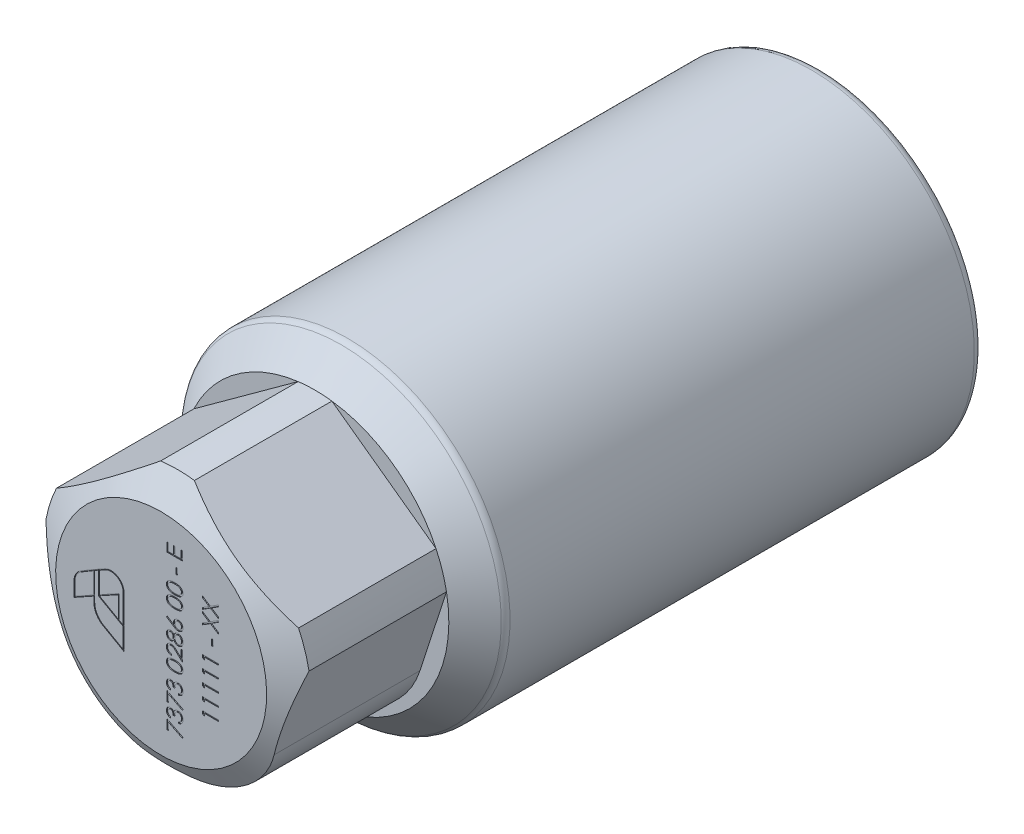
from build123d import *

# Parameters (mm, degrees)
SKETCH2_OUTSIDE_W      = 57.29
SKETCH2_OUTSIDE_H      = 57.29
CUT_EXTRUDE3_DEPTH     = 17.5
SKETCH3_W              = 0.184615385
SKETCH3_H              = 0.692307692
P_N_CUT_EXTRUDE7_DEPTH = 0.1


with BuildPart() as part:
    # Sketch1 → Revolve1 (revolve)
    with BuildSketch(Plane(origin=(0, 0, 0), x_dir=(0, 0, -1), z_dir=(1, 0, 0))):
        with BuildLine():
            Line((0, 10.75), (0, 17.5))
            ThreePointArc((0, 17.5), (-0.292893219, 18.207106781), (-1, 18.5))
            Line((-1, 18.5), (-53.810786438, 18.5))
            ThreePointArc((-53.810786438, 18.5), (-54.19346987, 18.423879533), (-54.517893219, 18.207106781))
            Line((-54.517893219, 18.207106781), (-57.5, 15.225))
            Line((-57.5, 15.225), (-73.138045382, 15.225))
            Line((-73.138045382, 15.225), (-75, 12))
            Line((-75, 12), (-75, 0))
            Line((-75, 0), (-53, 0))
            Line((-53, 0), (-49.272077939, 9))
            Line((-49.272077939, 9), (-6.25, 9))
            Line((-6.25, 9), (-5, 10.25))
            Line((-5, 10.25), (-0.5, 10.25))
            Line((-0.5, 10.25), (0, 10.75))
        make_face()
    revolve(axis=Axis((0, 0, 0), (0, 0, 1)))

    # Sketch2 outside → Cut-Extrude3 (cut)
    with BuildSketch(Plane.XY.offset(75)):
        Rectangle(SKETCH2_OUTSIDE_W, SKETCH2_OUTSIDE_H)
        with BuildLine():
            Line((0, 16.5), (-15.692432519, 5.098780407))
            Line((-15.692432519, 5.098780407), (-11.943596546, -6.438950351))
            ThreePointArc((-11.943596546, -6.438950351), (-8.310883906, -11.438950351), (-2.433031383, -13.348780407))
            Line((-2.433031383, -13.348780407), (2.433031383, -13.348780407))
            ThreePointArc((2.433031383, -13.348780407), (8.310883906, -11.438950351), (11.943596546, -6.438950351))
            Line((11.943596546, -6.438950351), (15.692432519, 5.098780407))
            Line((15.692432519, 5.098780407), (0, 16.5))
        make_face(mode=Mode.SUBTRACT)
    extrude(amount=-CUT_EXTRUDE3_DEPTH, mode=Mode.SUBTRACT)

    # Sketch3 → P/N Cut-Extrude7 (cut)
    # profile 1 of 21: a face of its own
    with BuildSketch(Plane(origin=(0, 19, 75), x_dir=(1, 0, 0), z_dir=(0, 0, -1))):
        Polygon((0.650687376, 10.65491147), (0.650687376, 9.639526854), (0.83530276, 9.639526854), (0.83530276, 10.493373008), (1.389148914, 10.493373008), (1.389148914, 9.639526854), (1.573764299, 9.639526854), (1.573764299, 10.493373008), (2.266071991, 10.493373008), (2.266071991, 9.639526854), (2.450687376, 9.639526854), (2.450687376, 10.65491147), align=None)
    # profile 2 of 21: a face of its own
    with BuildSketch(Plane(origin=(0, 19, 75), x_dir=(1, 0, 0), z_dir=(0, 0, -1))):
        with Locations((1.758379684, 11.993373008)):
            Rectangle(SKETCH3_W, SKETCH3_H)
    # profile 3 of 21: a face of its own
    with BuildSketch(Plane(origin=(0, 19, 75), x_dir=(1, 0, 0), z_dir=(0, 0, -1))):
        with BuildLine():
            add(Edge.make_bspline(
                [(1.55140853, 14.416449931), (1.522558444, 14.416281236), (1.466516738, 14.415953544), (1.384856065, 14.41230807), (1.308247916, 14.40625218), (1.236688626, 14.397952959), (1.170159717, 14.387853427), (1.108838989, 14.374371173), (1.052442606, 14.359038888), (1.000786742, 14.341269015), (0.95317519, 14.321218303), (0.908728517, 14.299394435), (0.867510633, 14.274934434), (0.828875608, 14.249225253), (0.793413508, 14.221266037), (0.760715743, 14.191656284), (0.731058058, 14.159803796), (0.704420145, 14.126017512), (0.681062581, 14.090526417), (0.660361734, 14.054300351), (0.643310557, 14.016692034), (0.629362224, 13.978196559), (0.617975878, 13.938732792), (0.610154625, 13.898310807), (0.605242256, 13.856836904), (0.604772013, 13.828843759), (0.60453353, 13.814647047)],
                knots=[0, 0, 0, 0, 1.646148282, 3.197666765, 4.66315463, 6.030252048, 7.307778049, 8.501004361, 9.610818041, 10.641065266, 11.615491391, 12.557119604, 13.464013759, 14.348536654, 15.203310953, 16.038349431, 16.863300206, 17.683791446, 18.490318933, 19.285717724, 20.06220424, 20.843281102, 21.620494212, 22.403315558, 23.190242141, 24, 24, 24, 24], degree=3))
            add(Edge.make_bspline(
                [(0.60453353, 13.814647047), (0.604732172, 13.800324715), (0.605127402, 13.771828316), (0.610690491, 13.729849669), (0.617870932, 13.688602218), (0.629387177, 13.648711768), (0.643167857, 13.609424069), (0.661351246, 13.571716125), (0.681127093, 13.534256649), (0.705251963, 13.498747372), (0.731913914, 13.464127344), (0.762182045, 13.431674682), (0.795218682, 13.400559809), (0.831760638, 13.371957923), (0.871247617, 13.344643186), (0.914010634, 13.319652493), (0.959954919, 13.296466083), (1.008867482, 13.274648113), (1.062054854, 13.255568875), (1.11918529, 13.238605907), (1.180776134, 13.224701884), (1.246484286, 13.213203502), (1.316635263, 13.204278569), (1.391086932, 13.197783153), (1.46988587, 13.194350891), (1.523761352, 13.193704642), (1.55140853, 13.193373008)],
                knots=[0, 0, 0, 0, 0.810910589, 1.61342667, 2.396193133, 3.181089899, 3.963115317, 4.752255436, 5.550715454, 6.36105385, 7.181178335, 8.024612154, 8.872680183, 9.750181803, 10.651284446, 11.591556747, 12.554036451, 13.566402641, 14.62422919, 15.753422176, 16.94128843, 18.199818041, 19.531985927, 20.947085226, 22.433341622, 24, 24, 24, 24], degree=3))
            add(Edge.make_bspline(
                [(1.55140853, 13.193373008), (1.57893487, 13.193711938), (1.632688878, 13.194373808), (1.711136955, 13.197709541), (1.785187314, 13.204437222), (1.854918902, 13.212729935), (1.92036405, 13.224356834), (1.981480114, 13.238366285), (2.038483473, 13.254327971), (2.090965705, 13.273700025), (2.13979339, 13.295010163), (2.18539985, 13.318171692), (2.228151573, 13.343021359), (2.267742705, 13.369926439), (2.304137988, 13.398998797), (2.337287935, 13.43009186), (2.367748584, 13.462827872), (2.394704271, 13.497649729), (2.419012816, 13.533489753), (2.439506317, 13.570953035), (2.457262734, 13.60908079), (2.471780242, 13.648253688), (2.48303874, 13.688411246), (2.490778343, 13.729686968), (2.49621869, 13.77183424), (2.496632993, 13.800326697), (2.496841222, 13.814647047)],
                knots=[0, 0, 0, 0, 1.561645053, 3.049612875, 4.452756685, 5.778837748, 7.032101753, 8.221335837, 9.334924186, 10.387562255, 11.392109817, 12.355697819, 13.287721948, 14.19548756, 15.068665045, 15.927346723, 16.771751757, 17.602390507, 18.423119567, 19.225778204, 20.022010933, 20.807278863, 21.593079439, 22.384715467, 23.188155646, 24, 24, 24, 24], degree=3))
            add(Edge.make_bspline(
                [(2.496841222, 13.814647047), (2.496601382, 13.828843448), (2.496128464, 13.856835981), (2.491235688, 13.898314371), (2.483369429, 13.938573913), (2.472355177, 13.977813274), (2.458873257, 14.016233761), (2.441308521, 14.053311875), (2.421079512, 14.089459739), (2.398042092, 14.124581444), (2.371647222, 14.158014995), (2.34245744, 14.189956277), (2.309724219, 14.219573332), (2.273962911, 14.247290117), (2.235270404, 14.27327109), (2.193620733, 14.297519724), (2.14894278, 14.319801255), (2.100954949, 14.34019453), (2.048932456, 14.358275443), (1.992392313, 14.374184881), (1.930760242, 14.38689126), (1.86434916, 14.397661881), (1.793024125, 14.406292521), (1.716759334, 14.412305555), (1.635699605, 14.415950776), (1.580018277, 14.41628051), (1.55140853, 14.416449931)],
                knots=[0, 0, 0, 0, 0.810927267, 1.598990287, 2.382942141, 3.152806972, 3.926217614, 4.706701772, 5.493896336, 6.292070767, 7.104102563, 7.925577746, 8.761822141, 9.623241997, 10.509042271, 11.423174113, 12.375371989, 13.360203808, 14.400680605, 15.520553799, 16.714061498, 17.994519714, 19.364400916, 20.818312473, 22.365209998, 24, 24, 24, 24], degree=3))
        make_face()
        with BuildLine():
            add(Edge.make_bspline(
                [(1.550687376, 14.25491147), (1.574729468, 14.254848693), (1.621390447, 14.254726855), (1.689077042, 14.251636045), (1.752314402, 14.247333954), (1.811077845, 14.241921675), (1.865161996, 14.233816017), (1.914791702, 14.224619653), (1.959875098, 14.213589176), (2.000806161, 14.200473788), (2.038164491, 14.185534085), (2.072945819, 14.169251194), (2.10556237, 14.151603735), (2.13593501, 14.132229973), (2.163692468, 14.110746876), (2.189538332, 14.088150402), (2.212573705, 14.063422593), (2.24020564, 14.029222189), (2.268757874, 13.984068999), (2.293621717, 13.927178695), (2.309246945, 13.868720581), (2.311234024, 13.829042802), (2.312225837, 13.809238393)],
                knots=[0, 0, 0, 0, 1.459098681, 2.831824031, 4.11146945, 5.306290378, 6.412266529, 7.42953815, 8.369053297, 9.227277979, 10.03601793, 10.809473603, 11.557037441, 12.285528272, 12.993193355, 13.685654407, 14.36688038, 15.041354379, 16.352855396, 17.594313975, 18.799247529, 20, 20, 20, 20], degree=3))
            add(Edge.make_bspline(
                [(2.312225837, 13.809238393), (2.311357387, 13.789319343), (2.309623566, 13.749551902), (2.294491463, 13.691147486), (2.269891469, 13.634917293), (2.241786559, 13.590541021), (2.214849974, 13.556874027), (2.191910424, 13.532743281), (2.166217411, 13.510597643), (2.138498169, 13.489592993), (2.108220781, 13.470328368), (2.075531488, 13.452810171), (2.04033933, 13.436824453), (2.015772037, 13.427716943), (2.003211414, 13.423060508)],
                knots=[0, 0, 0, 0, 1.353621445, 2.702441307, 4.075953605, 5.516772412, 6.261413105, 7.007624062, 7.778524365, 8.566925914, 9.372323995, 10.217594641, 11.088702136, 12, 12, 12, 12], degree=3))
            add(Edge.make_bspline(
                [(2.003211414, 13.423060508), (1.987150405, 13.417633885), (1.954539669, 13.406615512), (1.903952648, 13.392415171), (1.850876941, 13.381231823), (1.795629738, 13.371170663), (1.737803606, 13.364303377), (1.677577466, 13.35877593), (1.614905908, 13.355520149), (1.572325627, 13.355116562), (1.550687376, 13.35491147)],
                knots=[0, 0, 0, 0, 0.884706709, 1.796334032, 2.740027952, 3.714592787, 4.726048262, 5.777819803, 6.87074269, 8, 8, 8, 8], degree=3))
            add(Edge.make_bspline(
                [(1.550687376, 13.35491147), (1.529052624, 13.355194424), (1.486730425, 13.355747944), (1.424749646, 13.357863709), (1.365880512, 13.363327261), (1.309869412, 13.36939538), (1.257026398, 13.378342521), (1.206909103, 13.387989397), (1.16013839, 13.400950006), (1.115982084, 13.414794511), (1.074941572, 13.430639687), (1.036826516, 13.448082653), (1.001449396, 13.466708927), (0.968919517, 13.486949276), (0.939048191, 13.508521772), (0.912522756, 13.532199883), (0.888052896, 13.556479874), (0.860620375, 13.591011139), (0.832428931, 13.635851038), (0.807191189, 13.692031896), (0.792254811, 13.750176662), (0.790183467, 13.789565344), (0.789148914, 13.809238393)],
                knots=[0, 0, 0, 0, 1.313483664, 2.569454835, 3.763100662, 4.901599063, 5.988328865, 7.015709358, 7.99797933, 8.932480776, 9.824041341, 10.666387587, 11.475829342, 12.24921787, 12.990555181, 13.709176526, 14.405678811, 15.080244297, 16.38186033, 17.610124501, 18.806354173, 20, 20, 20, 20], degree=3))
            add(Edge.make_bspline(
                [(0.789148914, 13.809238393), (0.790186041, 13.829149721), (0.792262183, 13.869008653), (0.807122112, 13.927774351), (0.832355091, 13.984334745), (0.860566061, 14.029322509), (0.887947716, 14.063434277), (0.911252658, 14.087640788), (0.936481205, 14.110550644), (0.964484903, 14.131477439), (0.994750525, 14.15073632), (1.026945287, 14.16906579), (1.061791604, 14.185130936), (1.09912064, 14.200118602), (1.140053954, 14.213255866), (1.185300478, 14.224160308), (1.235048703, 14.234087513), (1.289528023, 14.241236718), (1.348304009, 14.247532069), (1.411703087, 14.251588816), (1.479622112, 14.254741014), (1.526524508, 14.254853513), (1.550687376, 14.25491147)],
                knots=[0, 0, 0, 0, 1.207546505, 2.417292871, 3.651582144, 4.952510111, 5.626719005, 6.30238548, 6.989136872, 7.692112372, 8.420316868, 9.164734959, 9.937886623, 10.746308695, 11.604196049, 12.543341915, 13.568754172, 14.680483261, 15.875568977, 17.154711427, 18.534182925, 20, 20, 20, 20], degree=3))
        make_face(mode=Mode.SUBTRACT)
    # profile 4 of 21: a face of its own
    with BuildSketch(Plane(origin=(0, 19, 75), x_dir=(1, 0, 0), z_dir=(0, 0, -1))):
        with BuildLine():
            add(Edge.make_bspline(
                [(1.55140853, 15.801065316), (1.522558444, 15.800896621), (1.466516738, 15.800568928), (1.384856065, 15.796923455), (1.308247916, 15.790867564), (1.236688626, 15.782568344), (1.170159717, 15.772468812), (1.108838989, 15.758986558), (1.052442606, 15.743654273), (1.000786742, 15.725884399), (0.95317519, 15.705833688), (0.908728517, 15.68400982), (0.867510633, 15.659549819), (0.828875608, 15.633840638), (0.793413508, 15.605881422), (0.760715743, 15.576271669), (0.731058058, 15.54441918), (0.704420145, 15.510632896), (0.681062581, 15.475141802), (0.660361734, 15.438915736), (0.643310557, 15.401307419), (0.629362224, 15.362811944), (0.617975878, 15.323348177), (0.610154625, 15.282926192), (0.605242256, 15.241452289), (0.604772013, 15.213459143), (0.60453353, 15.199262431)],
                knots=[0, 0, 0, 0, 1.646148282, 3.197666765, 4.66315463, 6.030252048, 7.307778049, 8.501004361, 9.610818041, 10.641065266, 11.615491391, 12.557119604, 13.464013759, 14.348536654, 15.203310953, 16.038349431, 16.863300206, 17.683791446, 18.490318933, 19.285717724, 20.06220424, 20.843281102, 21.620494212, 22.403315558, 23.190242141, 24, 24, 24, 24], degree=3))
            add(Edge.make_bspline(
                [(0.60453353, 15.199262431), (0.604732172, 15.1849401), (0.605127402, 15.156443701), (0.610690491, 15.114465053), (0.617870932, 15.073217602), (0.629387177, 15.033327153), (0.643167857, 14.994039453), (0.661351246, 14.95633151), (0.681127093, 14.918872033), (0.705251963, 14.883362757), (0.731913914, 14.848742728), (0.762182045, 14.816290066), (0.795218682, 14.785175194), (0.831760638, 14.756573308), (0.871247617, 14.729258571), (0.914010634, 14.704267877), (0.959954919, 14.681081467), (1.008867482, 14.659263498), (1.062054854, 14.640184259), (1.11918529, 14.623221291), (1.180776134, 14.609317269), (1.246484286, 14.597818887), (1.316635263, 14.588893953), (1.391086932, 14.582398538), (1.46988587, 14.578966275), (1.523761352, 14.578320027), (1.55140853, 14.577988393)],
                knots=[0, 0, 0, 0, 0.810910589, 1.61342667, 2.396193133, 3.181089899, 3.963115317, 4.752255436, 5.550715454, 6.36105385, 7.181178335, 8.024612154, 8.872680183, 9.750181803, 10.651284446, 11.591556747, 12.554036451, 13.566402641, 14.62422919, 15.753422176, 16.94128843, 18.199818041, 19.531985927, 20.947085226, 22.433341622, 24, 24, 24, 24], degree=3))
            add(Edge.make_bspline(
                [(1.55140853, 14.577988393), (1.57893487, 14.578327323), (1.632688878, 14.578989193), (1.711136955, 14.582324925), (1.785187314, 14.589052606), (1.854918902, 14.59734532), (1.92036405, 14.608972218), (1.981480114, 14.62298167), (2.038483473, 14.638943356), (2.090965705, 14.658315409), (2.13979339, 14.679625548), (2.18539985, 14.702787077), (2.228151573, 14.727636744), (2.267742705, 14.754541823), (2.304137988, 14.783614181), (2.337287935, 14.814707245), (2.367748584, 14.847443257), (2.394704271, 14.882265114), (2.419012816, 14.918105137), (2.439506317, 14.95556842), (2.457262734, 14.993696175), (2.471780242, 15.032869072), (2.48303874, 15.073026631), (2.490778343, 15.114302353), (2.49621869, 15.156449625), (2.496632993, 15.184942081), (2.496841222, 15.199262431)],
                knots=[0, 0, 0, 0, 1.561645053, 3.049612875, 4.452756685, 5.778837748, 7.032101753, 8.221335837, 9.334924186, 10.387562255, 11.392109817, 12.355697819, 13.287721948, 14.19548756, 15.068665045, 15.927346723, 16.771751757, 17.602390507, 18.423119567, 19.225778204, 20.022010933, 20.807278863, 21.593079439, 22.384715467, 23.188155646, 24, 24, 24, 24], degree=3))
            add(Edge.make_bspline(
                [(2.496841222, 15.199262431), (2.496601382, 15.213458833), (2.496128464, 15.241451365), (2.491235688, 15.282929756), (2.483369429, 15.323189298), (2.472355177, 15.362428658), (2.458873257, 15.400849146), (2.441308521, 15.437927259), (2.421079512, 15.474075123), (2.398042092, 15.509196829), (2.371647222, 15.542630379), (2.34245744, 15.574571662), (2.309724219, 15.604188716), (2.273962911, 15.631905501), (2.235270404, 15.657886474), (2.193620733, 15.682135109), (2.14894278, 15.70441664), (2.100954949, 15.724809914), (2.048932456, 15.742890827), (1.992392313, 15.758800265), (1.930760242, 15.771506645), (1.86434916, 15.782277266), (1.793024125, 15.790907906), (1.716759334, 15.79692094), (1.635699605, 15.800566161), (1.580018277, 15.800895895), (1.55140853, 15.801065316)],
                knots=[0, 0, 0, 0, 0.810927267, 1.598990287, 2.382942141, 3.152806972, 3.926217614, 4.706701772, 5.493896336, 6.292070767, 7.104102563, 7.925577746, 8.761822141, 9.623241997, 10.509042271, 11.423174113, 12.375371989, 13.360203808, 14.400680605, 15.520553799, 16.714061498, 17.994519714, 19.364400916, 20.818312473, 22.365209998, 24, 24, 24, 24], degree=3))
        make_face()
        with BuildLine():
            add(Edge.make_bspline(
                [(1.550687376, 15.639526854), (1.574729468, 15.639464077), (1.621390447, 15.63934224), (1.689077042, 15.63625143), (1.752314402, 15.631949338), (1.811077845, 15.626537059), (1.865161996, 15.618431402), (1.914791702, 15.609235038), (1.959875098, 15.598204561), (2.000806161, 15.585089173), (2.038164491, 15.57014947), (2.072945819, 15.553866579), (2.10556237, 15.53621912), (2.13593501, 15.516845358), (2.163692468, 15.495362261), (2.189538332, 15.472765787), (2.212573705, 15.448037978), (2.24020564, 15.413837574), (2.268757874, 15.368684383), (2.293621717, 15.31179408), (2.309246945, 15.253335965), (2.311234024, 15.213658187), (2.312225837, 15.193853777)],
                knots=[0, 0, 0, 0, 1.459098681, 2.831824031, 4.11146945, 5.306290378, 6.412266529, 7.42953815, 8.369053297, 9.227277979, 10.03601793, 10.809473603, 11.557037441, 12.285528272, 12.993193355, 13.685654407, 14.36688038, 15.041354379, 16.352855396, 17.594313975, 18.799247529, 20, 20, 20, 20], degree=3))
            add(Edge.make_bspline(
                [(2.312225837, 15.193853777), (2.311357387, 15.173934728), (2.309623566, 15.134167286), (2.294491463, 15.075762871), (2.269891469, 15.019532678), (2.241786559, 14.975156406), (2.214849974, 14.941489412), (2.191910424, 14.917358666), (2.166217411, 14.895213028), (2.138498169, 14.874208377), (2.108220781, 14.854943753), (2.075531488, 14.837425555), (2.04033933, 14.821439837), (2.015772037, 14.812332327), (2.003211414, 14.807675893)],
                knots=[0, 0, 0, 0, 1.353621445, 2.702441307, 4.075953605, 5.516772412, 6.261413105, 7.007624062, 7.778524365, 8.566925914, 9.372323995, 10.217594641, 11.088702136, 12, 12, 12, 12], degree=3))
            add(Edge.make_bspline(
                [(2.003211414, 14.807675893), (1.987150405, 14.802249269), (1.954539669, 14.791230896), (1.903952648, 14.777030555), (1.850876941, 14.765847207), (1.795629738, 14.755786048), (1.737803606, 14.748918762), (1.677577466, 14.743391315), (1.614905908, 14.740135533), (1.572325627, 14.739731947), (1.550687376, 14.739526854)],
                knots=[0, 0, 0, 0, 0.884706709, 1.796334032, 2.740027952, 3.714592787, 4.726048262, 5.777819803, 6.87074269, 8, 8, 8, 8], degree=3))
            add(Edge.make_bspline(
                [(1.550687376, 14.739526854), (1.529052624, 14.739809809), (1.486730425, 14.740363328), (1.424749646, 14.742479093), (1.365880512, 14.747942646), (1.309869412, 14.754010764), (1.257026398, 14.762957905), (1.206909103, 14.772604782), (1.16013839, 14.785565391), (1.115982084, 14.799409896), (1.074941572, 14.815255072), (1.036826516, 14.832698038), (1.001449396, 14.851324312), (0.968919517, 14.871564661), (0.939048191, 14.893137156), (0.912522756, 14.916815267), (0.888052896, 14.941095258), (0.860620375, 14.975626524), (0.832428931, 15.020466422), (0.807191189, 15.07664728), (0.792254811, 15.134792047), (0.790183467, 15.174180729), (0.789148914, 15.193853777)],
                knots=[0, 0, 0, 0, 1.313483664, 2.569454835, 3.763100662, 4.901599063, 5.988328865, 7.015709358, 7.99797933, 8.932480776, 9.824041341, 10.666387587, 11.475829342, 12.24921787, 12.990555181, 13.709176526, 14.405678811, 15.080244297, 16.38186033, 17.610124501, 18.806354173, 20, 20, 20, 20], degree=3))
            add(Edge.make_bspline(
                [(0.789148914, 15.193853777), (0.790186041, 15.213765106), (0.792262183, 15.253624037), (0.807122112, 15.312389735), (0.832355091, 15.368950129), (0.860566061, 15.413937893), (0.887947716, 15.448049662), (0.911252658, 15.472256172), (0.936481205, 15.495166028), (0.964484903, 15.516092823), (0.994750525, 15.535351704), (1.026945287, 15.553681175), (1.061791604, 15.569746321), (1.09912064, 15.584733987), (1.140053954, 15.597871251), (1.185300478, 15.608775693), (1.235048703, 15.618702897), (1.289528023, 15.625852103), (1.348304009, 15.632147453), (1.411703087, 15.636204201), (1.479622112, 15.639356399), (1.526524508, 15.639468898), (1.550687376, 15.639526854)],
                knots=[0, 0, 0, 0, 1.207546505, 2.417292871, 3.651582144, 4.952510111, 5.626719005, 6.30238548, 6.989136872, 7.692112372, 8.420316868, 9.164734959, 9.937886623, 10.746308695, 11.604196049, 12.543341915, 13.568754172, 14.680483261, 15.875568977, 17.154711427, 18.534182925, 20, 20, 20, 20], degree=3))
        make_face(mode=Mode.SUBTRACT)
    # profile 5 of 21: a face of its own
    with BuildSketch(Plane(origin=(0, 19, 75), x_dir=(1, 0, 0), z_dir=(0, 0, -1))):
        with BuildLine():
            Line((0.60453353, 17.047219162), (0.702249876, 16.922459547))
            Line((0.702249876, 16.922459547), (1.42953353, 17.398060508))
            add(Edge.make_bspline(
                [(1.42953353, 17.398060508), (1.424486401, 17.366395794), (1.414641407, 17.30463019), (1.41301732, 17.242110585), (1.412225837, 17.211642239)],
                knots=[0, 0, 0, 0, 1.025318673, 2, 2, 2, 2], degree=3))
            add(Edge.make_bspline(
                [(1.412225837, 17.211642239), (1.41271043, 17.193346891), (1.413661182, 17.157452161), (1.42117468, 17.104709882), (1.432869398, 17.054018077), (1.449985332, 17.005489847), (1.47184248, 16.959063558), (1.498039982, 16.914473898), (1.529928356, 16.872558178), (1.565551023, 16.832779075), (1.605002989, 16.796656698), (1.646875493, 16.764700632), (1.691165214, 16.737711066), (1.737862194, 16.716208328), (1.786600896, 16.699023833), (1.837571404, 16.686790564), (1.890859744, 16.679477331), (1.927106743, 16.678489951), (1.945519106, 16.677988393)],
                knots=[0, 0, 0, 0, 1.044153292, 2.048586451, 3.035616504, 4.010066907, 4.980134143, 5.961638459, 6.956651169, 7.981872067, 9.006633554, 10.00577864, 10.984929282, 11.961214264, 12.935664667, 13.930961288, 14.948991769, 16, 16, 16, 16], degree=3))
            add(Edge.make_bspline(
                [(1.945519106, 16.677988393), (1.970709611, 16.678718497), (2.020278563, 16.680155168), (2.092458831, 16.694531101), (2.161182492, 16.716703147), (2.225260377, 16.748901787), (2.285136294, 16.788138084), (2.338015508, 16.836574061), (2.385175338, 16.891806594), (2.424594499, 16.954292234), (2.456791505, 17.021529651), (2.479916181, 17.092168304), (2.494153475, 17.165519281), (2.495938345, 17.215304525), (2.496841222, 17.240488393)],
                knots=[0, 0, 0, 0, 1.031403119, 2.029557249, 3.004870281, 3.983165322, 4.960181699, 5.929903783, 6.912123683, 7.928973898, 8.949315281, 9.960468141, 10.968302741, 12, 12, 12, 12], degree=3))
            add(Edge.make_bspline(
                [(2.496841222, 17.240488393), (2.496057521, 17.264710573), (2.494505147, 17.31269047), (2.480604284, 17.383252425), (2.45823361, 17.451173928), (2.426767768, 17.515583113), (2.387693776, 17.575347522), (2.340981745, 17.629243003), (2.286566779, 17.675825115), (2.225639239, 17.714940068), (2.160259655, 17.74609512), (2.091969819, 17.769240449), (2.021056427, 17.782831475), (1.972979523, 17.784726314), (1.948764299, 17.7856807)],
                knots=[0, 0, 0, 0, 1.012172929, 2.004937354, 2.995255351, 3.995689452, 4.993936421, 5.973737378, 6.968231049, 7.979117505, 8.993136101, 9.989812463, 10.987515067, 12, 12, 12, 12], degree=3))
            add(Edge.make_bspline(
                [(1.948764299, 17.7856807), (1.930227085, 17.7850731), (1.892377635, 17.783832496), (1.835053278, 17.775170181), (1.776398436, 17.761251144), (1.726639136, 17.745663017), (1.685876068, 17.729192704), (1.653011415, 17.715485683), (1.619191435, 17.698424771), (1.583256422, 17.680232746), (1.546132485, 17.659272071), (1.50719917, 17.636481166), (1.467075664, 17.611229917), (1.439847221, 17.593528119), (1.42592776, 17.584478777)],
                knots=[0, 0, 0, 0, 1.173818275, 2.396712641, 3.66331629, 4.989737886, 5.693666774, 6.447286557, 7.243889047, 8.091586357, 8.998013824, 9.943181721, 10.948533338, 12, 12, 12, 12], degree=3))
            Line((1.42592776, 17.584478777), (0.60453353, 17.047219162))
        make_face()
        with BuildLine():
            add(Edge.make_bspline(
                [(1.596841222, 17.24553647), (1.597242773, 17.259249399), (1.598030613, 17.286154054), (1.602578218, 17.325554384), (1.610902311, 17.36286602), (1.622616966, 17.398030196), (1.636937382, 17.431556945), (1.655067064, 17.462946448), (1.676551308, 17.492359702), (1.700872701, 17.51949004), (1.727507814, 17.544081664), (1.756034667, 17.565260881), (1.785767771, 17.583529454), (1.816955033, 17.598382984), (1.849584668, 17.609949303), (1.883506566, 17.618315833), (1.918948209, 17.622972048), (1.942982068, 17.623746681), (1.955254683, 17.624142239)],
                knots=[0, 0, 0, 0, 1.129021685, 2.215131248, 3.259331325, 4.269943947, 5.262523737, 6.255350063, 7.246844365, 8.255857416, 9.250210903, 10.225779748, 11.176033868, 12.118685626, 13.063774722, 14.021264189, 14.989581131, 16, 16, 16, 16], degree=3))
            add(Edge.make_bspline(
                [(1.955254683, 17.624142239), (1.967415405, 17.623808703), (1.991379599, 17.623151429), (2.026556589, 17.617555405), (2.060330846, 17.608610745), (2.09257544, 17.595689579), (2.123909382, 17.57998779), (2.153354543, 17.559833335), (2.181864712, 17.536701875), (2.208115214, 17.509693784), (2.23248511, 17.480487345), (2.253874244, 17.44934914), (2.271960975, 17.416748005), (2.286947829, 17.382777835), (2.297980292, 17.347018714), (2.306426242, 17.310051282), (2.311043758, 17.271372922), (2.311826639, 17.245186985), (2.312225837, 17.231834547)],
                knots=[0, 0, 0, 0, 0.989367052, 1.949669134, 2.891858276, 3.827522767, 4.772653562, 5.738670152, 6.725809442, 7.756636004, 8.798867547, 9.819240912, 10.826537776, 11.829883227, 12.835515726, 13.868058748, 14.912904531, 16, 16, 16, 16], degree=3))
            add(Edge.make_bspline(
                [(2.312225837, 17.231834547), (2.311826608, 17.21848213), (2.311043666, 17.192296236), (2.306426592, 17.153617565), (2.29797901, 17.116651282), (2.286952475, 17.080887985), (2.271943637, 17.046933305), (2.253987431, 17.014360668), (2.232353963, 16.983516962), (2.208157057, 16.954291516), (2.181714712, 16.927395666), (2.153611433, 16.903720179), (2.123673776, 16.884195393), (2.092698644, 16.867871038), (2.060311586, 16.855092943), (2.026561845, 16.846104246), (1.991378228, 16.840520127), (1.967414944, 16.839861219), (1.955254683, 16.839526854)],
                knots=[0, 0, 0, 0, 1.087281468, 2.132306021, 3.165025708, 4.170830268, 5.174347389, 6.181816599, 7.194310624, 8.23672049, 9.267723423, 10.261267456, 11.222032883, 12.171822355, 13.107646935, 14.049997283, 15.01046367, 16, 16, 16, 16], degree=3))
            add(Edge.make_bspline(
                [(1.955254683, 16.839526854), (1.942966058, 16.839809862), (1.918847482, 16.840365315), (1.883522414, 16.846647799), (1.849412334, 16.855361037), (1.816731465, 16.868517959), (1.785609349, 16.885611285), (1.755886561, 16.906430375), (1.727343847, 16.930519416), (1.700804534, 16.958326514), (1.676700752, 16.988589695), (1.654987424, 17.02058836), (1.637097918, 17.054361975), (1.622571763, 17.089808097), (1.611079101, 17.126470042), (1.60255041, 17.164794879), (1.59806873, 17.204684245), (1.597253221, 17.231824898), (1.596841222, 17.24553647)],
                knots=[0, 0, 0, 0, 0.978806326, 1.921078492, 2.853353314, 3.782420107, 4.721762923, 5.678931303, 6.671762224, 7.695345257, 8.738662256, 9.754135789, 10.774617798, 11.780273614, 12.804888236, 13.835135845, 14.906301534, 16, 16, 16, 16], degree=3))
        make_face(mode=Mode.SUBTRACT)
    # profile 6 of 21: a face of its own
    with BuildSketch(Plane(origin=(0, 19, 75), x_dir=(1, 0, 0), z_dir=(0, 0, -1))):
        with BuildLine():
            add(Edge.make_bspline(
                [(1.447922953, 18.387483585), (1.455594429, 18.372742626), (1.470556369, 18.343992834), (1.494798883, 18.303227685), (1.519690131, 18.265455882), (1.54570568, 18.230884216), (1.572263217, 18.199070381), (1.599704341, 18.170483613), (1.627991949, 18.145003099), (1.657230647, 18.122669439), (1.687425576, 18.102904187), (1.718768696, 18.086137132), (1.750837126, 18.071510091), (1.784109759, 18.060028142), (1.818132241, 18.050548905), (1.853360532, 18.044031423), (1.889557989, 18.040525202), (1.914021715, 18.039862436), (1.92640853, 18.039526854)],
                knots=[0, 0, 0, 0, 1.272232798, 2.48127884, 3.629933602, 4.734339846, 5.792529071, 6.8014233, 7.765980239, 8.70477066, 9.616091719, 10.526157162, 11.424183119, 12.311964017, 13.218439077, 14.126407968, 15.05133675, 16, 16, 16, 16], degree=3))
            add(Edge.make_bspline(
                [(1.92640853, 18.039526854), (1.943738358, 18.039924875), (1.97804059, 18.040712707), (2.028676334, 18.047533943), (2.077937048, 18.057868129), (2.125727126, 18.072582567), (2.171594127, 18.092246448), (2.215803324, 18.116028248), (2.259108741, 18.143103796), (2.285759727, 18.164831009), (2.299245068, 18.175824931)],
                knots=[0, 0, 0, 0, 1.025234619, 2.029323995, 3.018511574, 4.001747246, 4.983437759, 5.966776356, 6.971193253, 8, 8, 8, 8], degree=3))
            add(Edge.make_bspline(
                [(2.299245068, 18.175824931), (2.314979009, 18.190140832), (2.346252462, 18.218595729), (2.386855736, 18.267341234), (2.420978282, 18.320838203), (2.448786685, 18.378879632), (2.470430841, 18.441310369), (2.485984135, 18.508117115), (2.494892813, 18.579430108), (2.496180579, 18.62844435), (2.496841222, 18.653589354)],
                knots=[0, 0, 0, 0, 0.954267603, 1.896743057, 2.838368354, 3.796610408, 4.779680527, 5.799409237, 6.871065594, 8, 8, 8, 8], degree=3))
            add(Edge.make_bspline(
                [(2.496841222, 18.653589354), (2.496248519, 18.677767668), (2.495095179, 18.724816212), (2.4872809, 18.793297407), (2.473586568, 18.857132126), (2.45484363, 18.916691547), (2.430461212, 18.971616556), (2.400114084, 19.021750843), (2.36502343, 19.067817012), (2.324182646, 19.108419723), (2.280435891, 19.144459129), (2.235316086, 19.176144252), (2.188857991, 19.202332049), (2.141767792, 19.224903788), (2.093091469, 19.241701552), (2.043328519, 19.253615633), (1.992620322, 19.261099338), (1.958405023, 19.262100246), (1.941192183, 19.262603777)],
                knots=[0, 0, 0, 0, 1.25688423, 2.445769047, 3.576901867, 4.645929967, 5.686364546, 6.692558921, 7.686102643, 8.689032542, 9.678639083, 10.630214757, 11.550908986, 12.44815258, 13.341318614, 14.221806242, 15.105436345, 16, 16, 16, 16], degree=3))
            add(Edge.make_bspline(
                [(1.941192183, 19.262603777), (1.92856178, 19.262306494), (1.903599644, 19.261718958), (1.866720012, 19.257654867), (1.830826892, 19.25111442), (1.795775551, 19.242255394), (1.76176228, 19.230124677), (1.72856915, 19.215785555), (1.696413821, 19.198738827), (1.665058031, 19.179169059), (1.634876044, 19.156385692), (1.605380708, 19.130568815), (1.576942898, 19.101374357), (1.549726491, 19.068593748), (1.522323843, 19.033378003), (1.496764719, 18.9942376), (1.471115154, 18.952415623), (1.455786329, 18.922686134), (1.447922953, 18.907435508)],
                knots=[0, 0, 0, 0, 0.941515718, 1.860767376, 2.762381872, 3.659935523, 4.55260077, 5.451495189, 6.353332278, 7.263234701, 8.204067976, 9.169206831, 10.183030162, 11.238523545, 12.34427893, 13.507326683, 14.721309093, 16, 16, 16, 16], degree=3))
            add(Edge.make_bspline(
                [(1.447922953, 18.907435508), (1.436504523, 18.928283499), (1.41442982, 18.968587922), (1.3744085, 19.022499946), (1.330116007, 19.06809371), (1.282006547, 19.105405765), (1.2310404, 19.13462872), (1.177641853, 19.154701955), (1.122757455, 19.168275605), (1.085263084, 19.169620599), (1.066432568, 19.170296085)],
                knots=[0, 0, 0, 0, 1.166795445, 2.255709742, 3.287146686, 4.280506455, 5.237809939, 6.161201476, 7.076514059, 8, 8, 8, 8], degree=3))
            add(Edge.make_bspline(
                [(1.066432568, 19.170296085), (1.047251831, 19.169453534), (1.008695206, 19.16775986), (0.951284456, 19.154111158), (0.89486543, 19.131702128), (0.839576685, 19.101739253), (0.787907391, 19.063628172), (0.74134806, 19.018508736), (0.700577109, 18.966744222), (0.666332954, 18.908813069), (0.63846844, 18.846461034), (0.619244886, 18.780676331), (0.606677837, 18.712601995), (0.605254973, 18.666266044), (0.60453353, 18.642772047)],
                knots=[0, 0, 0, 0, 0.888671842, 1.786385383, 2.719922424, 3.697584571, 4.694127107, 5.68736021, 6.695307759, 7.740011808, 8.800474061, 9.853175224, 10.911482437, 12, 12, 12, 12], degree=3))
            add(Edge.make_bspline(
                [(0.60453353, 18.642772047), (0.605277335, 18.619884341), (0.606744035, 18.574752394), (0.618977689, 18.508412717), (0.639408502, 18.444935498), (0.667132731, 18.38454905), (0.701253837, 18.32829972), (0.742621323, 18.278763363), (0.788631443, 18.234644428), (0.840595112, 18.198354616), (0.895671204, 18.168625823), (0.953144569, 18.147694739), (1.011858068, 18.134364777), (1.051579372, 18.132679106), (1.071480645, 18.131834547)],
                knots=[0, 0, 0, 0, 1.072838999, 2.115516285, 3.151283082, 4.193045685, 5.225601509, 6.226687556, 7.21162948, 8.206378771, 9.189883966, 10.138656908, 11.067424936, 12, 12, 12, 12], degree=3))
            add(Edge.make_bspline(
                [(1.071480645, 18.131834547), (1.091009671, 18.13257689), (1.129363567, 18.134034811), (1.185196076, 18.146134322), (1.237368451, 18.166836469), (1.286720745, 18.194734662), (1.332252719, 18.231409832), (1.374920953, 18.275694167), (1.414235608, 18.328051524), (1.436458969, 18.367258536), (1.447922953, 18.387483585)],
                knots=[0, 0, 0, 0, 0.97540661, 1.915643144, 2.83819279, 3.771804602, 4.738123289, 5.749225578, 6.838931607, 8, 8, 8, 8], degree=3))
        make_face()
        with BuildLine():
            add(Edge.make_bspline(
                [(0.789148914, 18.65178647), (0.789482856, 18.66441304), (0.790136193, 18.689116131), (0.793575826, 18.72533041), (0.800182822, 18.75979558), (0.809234317, 18.792700108), (0.820496191, 18.824156714), (0.835334094, 18.85344404), (0.851826485, 18.88154631), (0.871171308, 18.907541602), (0.892276928, 18.931073941), (0.914318425, 18.952092469), (0.93794557, 18.969216045), (0.96197633, 18.983948086), (0.987407441, 18.994888684), (1.013682079, 19.002660508), (1.040966668, 19.008160688), (1.059554113, 19.008557098), (1.068956606, 19.008757623)],
                knots=[0, 0, 0, 0, 1.20353747, 2.354645537, 3.462130888, 4.543058862, 5.604822423, 6.639552563, 7.666902586, 8.706944258, 9.720926464, 10.677177239, 11.602682187, 12.496457588, 13.358248655, 14.231532794, 15.105417644, 16, 16, 16, 16], degree=3))
            add(Edge.make_bspline(
                [(1.068956606, 19.008757623), (1.078358011, 19.008404121), (1.096936538, 19.007705548), (1.124371555, 19.002302911), (1.151331254, 18.994250814), (1.177174579, 18.981573331), (1.202798021, 18.966367775), (1.22756118, 18.94760073), (1.251550235, 18.925234944), (1.274561147, 18.900020832), (1.296109083, 18.872552041), (1.31481529, 18.843451676), (1.330467119, 18.813084961), (1.34349367, 18.781763897), (1.353619923, 18.749169267), (1.360803798, 18.715500794), (1.365268825, 18.680752822), (1.365802151, 18.657208523), (1.366071991, 18.645296085)],
                knots=[0, 0, 0, 0, 0.873023192, 1.725219244, 2.590779336, 3.480155217, 4.391973325, 5.357036234, 6.360879153, 7.436073238, 8.526419356, 9.601555421, 10.645666583, 11.697338044, 12.750135903, 13.812665442, 14.89329948, 16, 16, 16, 16], degree=3))
            add(Edge.make_bspline(
                [(1.366071991, 18.645296085), (1.365625352, 18.629995116), (1.364736484, 18.599544303), (1.356396692, 18.554671336), (1.343444205, 18.51093056), (1.325060491, 18.469149626), (1.302646326, 18.430076314), (1.276213753, 18.394812652), (1.245142023, 18.36483436), (1.211233531, 18.339330462), (1.175264814, 18.319390025), (1.139021592, 18.304115337), (1.102205333, 18.295119895), (1.077535609, 18.293950561), (1.065350837, 18.293373008)],
                knots=[0, 0, 0, 0, 1.076561449, 2.142489767, 3.202892658, 4.283174188, 5.348766409, 6.369549039, 7.375093932, 8.378927502, 9.349008457, 10.26378795, 11.142457041, 12, 12, 12, 12], degree=3))
            add(Edge.make_bspline(
                [(1.065350837, 18.293373008), (1.056797893, 18.293642203), (1.039821526, 18.294176516), (1.014662643, 18.298735453), (0.990089708, 18.30590247), (0.966051924, 18.316159801), (0.942665211, 18.329332173), (0.919308471, 18.344730454), (0.897061596, 18.363840203), (0.875152224, 18.385103845), (0.854935282, 18.409270201), (0.837023051, 18.436108405), (0.822418433, 18.46593121), (0.810013478, 18.498099458), (0.80082561, 18.532959805), (0.79390406, 18.570184629), (0.790012584, 18.610117716), (0.789443048, 18.637595637), (0.789148914, 18.65178647)],
                knots=[0, 0, 0, 0, 0.814197944, 1.616066217, 2.427603245, 3.248455667, 4.099186941, 4.981981106, 5.90846497, 6.888109974, 7.887887681, 8.904052014, 9.953721043, 11.044545063, 12.183287691, 13.382474488, 14.648192314, 16, 16, 16, 16], degree=3))
        make_face(mode=Mode.SUBTRACT)
        with BuildLine():
            add(Edge.make_bspline(
                [(1.550687376, 18.641329739), (1.550972293, 18.657337186), (1.551531232, 18.688739891), (1.557746033, 18.734747723), (1.566410818, 18.778895641), (1.579505978, 18.821065061), (1.596685036, 18.861075333), (1.616711272, 18.899610746), (1.641084336, 18.935731093), (1.668776143, 18.969362567), (1.698636908, 19.000223454), (1.730575523, 19.026922659), (1.763354832, 19.049940276), (1.797722414, 19.068348233), (1.832919505, 19.083479664), (1.869850325, 19.093411089), (1.907797663, 19.099779206), (1.933594329, 19.100634222), (1.946600837, 19.101065316)],
                knots=[0, 0, 0, 0, 1.140120093, 2.236637429, 3.303440304, 4.343881959, 5.376465234, 6.40341898, 7.434544382, 8.475444373, 9.50525236, 10.49018835, 11.438301835, 12.354413346, 13.264416842, 14.162243115, 15.073415118, 16, 16, 16, 16], degree=3))
            add(Edge.make_bspline(
                [(1.946600837, 19.101065316), (1.962761444, 19.100349319), (1.994941069, 19.098923598), (2.042398028, 19.088076878), (2.088197912, 19.07012509), (2.132127467, 19.045547656), (2.173209352, 19.014926201), (2.209111549, 18.977455048), (2.240498199, 18.934913995), (2.266369294, 18.88665592), (2.286766723, 18.83368227), (2.301542285, 18.776472608), (2.310761023, 18.7154274), (2.311729871, 18.673334418), (2.312225837, 18.65178647)],
                knots=[0, 0, 0, 0, 0.898929492, 1.789983246, 2.69439732, 3.628772362, 4.584083338, 5.535003999, 6.506411961, 7.518169435, 8.572915583, 9.658441722, 10.801325702, 12, 12, 12, 12], degree=3))
            add(Edge.make_bspline(
                [(2.312225837, 18.65178647), (2.311898297, 18.634944743), (2.311260145, 18.602131658), (2.305756014, 18.554240613), (2.296738119, 18.509161837), (2.284631728, 18.466527207), (2.268281083, 18.426692734), (2.248294813, 18.389486883), (2.225334523, 18.354441825), (2.198163023, 18.323135433), (2.169113114, 18.294628189), (2.138364797, 18.269770744), (2.106748541, 18.248192657), (2.073551204, 18.231256716), (2.039409348, 18.217717505), (2.004008232, 18.20798539), (1.967239254, 18.20198048), (1.942296875, 18.201373162), (1.929653722, 18.201065316)],
                knots=[0, 0, 0, 0, 1.224881218, 2.3864614, 3.501053153, 4.5663711, 5.605533372, 6.626474706, 7.635288001, 8.646258782, 9.635558885, 10.592810877, 11.51917626, 12.414699553, 13.29797396, 14.186770504, 15.080884095, 16, 16, 16, 16], degree=3))
            add(Edge.make_bspline(
                [(1.929653722, 18.201065316), (1.917373925, 18.201531156), (1.893160311, 18.202449711), (1.857280695, 18.208280372), (1.822615203, 18.218521439), (1.788754005, 18.232580797), (1.756355583, 18.251270632), (1.724609526, 18.273436961), (1.694058934, 18.29977542), (1.665129736, 18.329962097), (1.638395201, 18.362697304), (1.614634377, 18.397384216), (1.595215036, 18.43418726), (1.57890126, 18.472375718), (1.566187872, 18.512335007), (1.557273067, 18.553872271), (1.55167012, 18.597066232), (1.551018658, 18.626408547), (1.550687376, 18.641329739)],
                knots=[0, 0, 0, 0, 0.917285732, 1.808727228, 2.70647511, 3.61182169, 4.540502712, 5.494399442, 6.50027777, 7.547876848, 8.61347749, 9.654284431, 10.682470341, 11.71628462, 12.752590585, 13.809114363, 14.885888007, 16, 16, 16, 16], degree=3))
        make_face(mode=Mode.SUBTRACT)
    # profile 7 of 21: a face of its own
    with BuildSketch(Plane(origin=(0, 19, 75), x_dir=(1, 0, 0), z_dir=(0, 0, -1))):
        with BuildLine():
            Line((1.20453353, 20.416449931), (1.20453353, 20.577988393))
            add(Edge.make_bspline(
                [(1.20453353, 20.577988393), (1.183102787, 20.576935571), (1.14101338, 20.574867858), (1.079646799, 20.565184737), (1.020990046, 20.551329429), (0.96551409, 20.531739539), (0.912728418, 20.507410596), (0.862842695, 20.478235153), (0.816047227, 20.443678316), (0.772775822, 20.404486281), (0.733079357, 20.361919552), (0.698799518, 20.315990783), (0.669836144, 20.267727627), (0.645622934, 20.217276507), (0.627448156, 20.164068217), (0.613962741, 20.108585605), (0.605849192, 20.050584906), (0.604977074, 20.01106718), (0.60453353, 19.990969162)],
                knots=[0, 0, 0, 0, 1.10065271, 2.161652631, 3.183658789, 4.190468796, 5.17591951, 6.163126047, 7.15150782, 8.156236427, 9.156009102, 10.134482811, 11.092018607, 12.041330605, 13.001268258, 13.972401359, 14.968799086, 16, 16, 16, 16], degree=3))
            add(Edge.make_bspline(
                [(0.60453353, 19.990969162), (0.604991843, 19.971230478), (0.605892413, 19.932444668), (0.613742559, 19.875860996), (0.625772208, 19.821866602), (0.643598252, 19.771073405), (0.665966038, 19.722960123), (0.693783311, 19.678122479), (0.72573385, 19.635476251), (0.763421079, 19.597114443), (0.803633446, 19.561874494), (0.846579917, 19.531499789), (0.89098789, 19.505340854), (0.937204256, 19.483930583), (0.985379518, 19.467700645), (1.035051804, 19.455675817), (1.086794365, 19.448801775), (1.121821601, 19.44775258), (1.139629683, 19.447219162)],
                knots=[0, 0, 0, 0, 1.111674182, 2.184400057, 3.212814286, 4.223731311, 5.211378316, 6.196328225, 7.191884489, 8.207283132, 9.220262353, 10.201199469, 11.166417575, 12.120932471, 13.06540007, 14.026332106, 14.996573967, 16, 16, 16, 16], degree=3))
            add(Edge.make_bspline(
                [(1.139629683, 19.447219162), (1.164700433, 19.448089244), (1.214401978, 19.44981414), (1.287431814, 19.464592361), (1.358218421, 19.487615074), (1.415183569, 19.515563497), (1.461189441, 19.543258359), (1.498986901, 19.568379334), (1.539521015, 19.598006529), (1.583285267, 19.631898752), (1.629515758, 19.670753571), (1.679501363, 19.713020291), (1.731648139, 19.760584991), (1.767306342, 19.793819821), (1.78578353, 19.811041277)],
                knots=[0, 0, 0, 0, 1.184287764, 2.347792955, 3.508658517, 4.695561027, 5.337795753, 6.047029248, 6.840419152, 7.71111932, 8.663527678, 9.695323177, 10.80577421, 12, 12, 12, 12], degree=3))
            Line((1.78578353, 19.811041277), (2.266071991, 20.261401854))
            Line((2.266071991, 20.261401854), (2.266071991, 19.424142239))
            Line((2.266071991, 19.424142239), (2.450687376, 19.424142239))
            Line((2.450687376, 19.424142239), (2.450687376, 20.647219162))
            Line((2.450687376, 20.647219162), (1.705735453, 19.949142239))
            add(Edge.make_bspline(
                [(1.705735453, 19.949142239), (1.687993466, 19.932146183), (1.653914742, 19.899500237), (1.604161219, 19.853326341), (1.558004313, 19.811854861), (1.515531231, 19.774817345), (1.47612071, 19.743017256), (1.441049148, 19.714797251), (1.408775431, 19.692186376), (1.371365972, 19.66764703), (1.325691066, 19.643879839), (1.269873741, 19.623456342), (1.212414011, 19.611002991), (1.173584392, 19.609509076), (1.15405276, 19.608757623)],
                knots=[0, 0, 0, 0, 1.329631726, 2.553950428, 3.673215718, 4.687767853, 5.603093632, 6.413772471, 7.123043292, 7.734684054, 8.834405432, 9.900288307, 10.943827018, 12, 12, 12, 12], degree=3))
            add(Edge.make_bspline(
                [(1.15405276, 19.608757623), (1.141770898, 19.609084577), (1.117565707, 19.609728939), (1.082077031, 19.615415754), (1.047843698, 19.624009729), (1.014760408, 19.636324433), (0.983159787, 19.652579328), (0.953003368, 19.672365638), (0.923849044, 19.695194813), (0.896513062, 19.721604037), (0.871477013, 19.750615676), (0.849298912, 19.781264147), (0.830764512, 19.813689915), (0.815570714, 19.847756264), (0.803651946, 19.88336822), (0.795393248, 19.92059466), (0.790207971, 19.959332725), (0.789506397, 19.985784237), (0.789148914, 19.999262431)],
                knots=[0, 0, 0, 0, 0.991446411, 1.95395049, 2.89581595, 3.838931463, 4.798493298, 5.75982156, 6.748411868, 7.785213223, 8.824556874, 9.840280684, 10.836137867, 11.835679398, 12.848801643, 13.863922112, 14.911575587, 16, 16, 16, 16], degree=3))
            add(Edge.make_bspline(
                [(0.789148914, 19.999262431), (0.789502135, 20.013342393), (0.790195802, 20.040993112), (0.795449985, 20.081504318), (0.803415327, 20.120417099), (0.81606603, 20.157150841), (0.831013464, 20.192500989), (0.850002569, 20.225712874), (0.87206833, 20.257337915), (0.89765448, 20.286855941), (0.926402368, 20.313815294), (0.958084526, 20.337835687), (0.992472867, 20.358685386), (1.029426255, 20.376901961), (1.069312607, 20.391688886), (1.111981272, 20.40298985), (1.157249535, 20.411931521), (1.188510418, 20.414918779), (1.20453353, 20.416449931)],
                knots=[0, 0, 0, 0, 1.030878251, 2.024474673, 2.987898669, 3.934362936, 4.864849709, 5.795128259, 6.730474222, 7.685293701, 8.650606017, 9.611896181, 10.591709709, 11.591680886, 12.625074257, 13.701333388, 14.821793024, 16, 16, 16, 16], degree=3))
        make_face()
    # profile 8 of 21: a face of its own
    with BuildSketch(Plane(origin=(0, 19, 75), x_dir=(1, 0, 0), z_dir=(0, 0, -1))):
        with BuildLine():
            add(Edge.make_bspline(
                [(1.55140853, 22.031834547), (1.522558444, 22.031665852), (1.466516738, 22.031338159), (1.384856065, 22.027692685), (1.308247916, 22.021636795), (1.236688626, 22.013337574), (1.170159717, 22.003238043), (1.108838989, 21.989755789), (1.052442606, 21.974423503), (1.000786742, 21.95665363), (0.95317519, 21.936602919), (0.908728517, 21.914779051), (0.867510633, 21.89031905), (0.828875608, 21.864609869), (0.793413508, 21.836650652), (0.760715743, 21.8070409), (0.731058058, 21.775188411), (0.704420145, 21.741402127), (0.681062581, 21.705911033), (0.660361734, 21.669684967), (0.643310557, 21.63207665), (0.629362224, 21.593581175), (0.617975878, 21.554117408), (0.610154625, 21.513695423), (0.605242256, 21.472221519), (0.604772013, 21.444228374), (0.60453353, 21.430031662)],
                knots=[0, 0, 0, 0, 1.646148282, 3.197666765, 4.66315463, 6.030252048, 7.307778049, 8.501004361, 9.610818041, 10.641065266, 11.615491391, 12.557119604, 13.464013759, 14.348536654, 15.203310953, 16.038349431, 16.863300206, 17.683791446, 18.490318933, 19.285717724, 20.06220424, 20.843281102, 21.620494212, 22.403315558, 23.190242141, 24, 24, 24, 24], degree=3))
            add(Edge.make_bspline(
                [(0.60453353, 21.430031662), (0.604732172, 21.415709331), (0.605127402, 21.387212932), (0.610690491, 21.345234284), (0.617870932, 21.303986833), (0.629387177, 21.264096383), (0.643167857, 21.224808684), (0.661351246, 21.187100741), (0.681127093, 21.149641264), (0.705251963, 21.114131988), (0.731913914, 21.079511959), (0.762182045, 21.047059297), (0.795218682, 21.015944425), (0.831760638, 20.987342539), (0.871247617, 20.960027801), (0.914010634, 20.935037108), (0.959954919, 20.911850698), (1.008867482, 20.890032729), (1.062054854, 20.87095349), (1.11918529, 20.853990522), (1.180776134, 20.8400865), (1.246484286, 20.828588118), (1.316635263, 20.819663184), (1.391086932, 20.813167769), (1.46988587, 20.809735506), (1.523761352, 20.809089258), (1.55140853, 20.808757623)],
                knots=[0, 0, 0, 0, 0.810910589, 1.61342667, 2.396193133, 3.181089899, 3.963115317, 4.752255436, 5.550715454, 6.36105385, 7.181178335, 8.024612154, 8.872680183, 9.750181803, 10.651284446, 11.591556747, 12.554036451, 13.566402641, 14.62422919, 15.753422176, 16.94128843, 18.199818041, 19.531985927, 20.947085226, 22.433341622, 24, 24, 24, 24], degree=3))
            add(Edge.make_bspline(
                [(1.55140853, 20.808757623), (1.57893487, 20.809096554), (1.632688878, 20.809758424), (1.711136955, 20.813094156), (1.785187314, 20.819821837), (1.854918902, 20.828114551), (1.92036405, 20.839741449), (1.981480114, 20.8537509), (2.038483473, 20.869712587), (2.090965705, 20.88908464), (2.13979339, 20.910394779), (2.18539985, 20.933556308), (2.228151573, 20.958405974), (2.267742705, 20.985311054), (2.304137988, 21.014383412), (2.337287935, 21.045476476), (2.367748584, 21.078212488), (2.394704271, 21.113034345), (2.419012816, 21.148874368), (2.439506317, 21.186337651), (2.457262734, 21.224465406), (2.471780242, 21.263638303), (2.48303874, 21.303795861), (2.490778343, 21.345071584), (2.49621869, 21.387218856), (2.496632993, 21.415711312), (2.496841222, 21.430031662)],
                knots=[0, 0, 0, 0, 1.561645053, 3.049612875, 4.452756685, 5.778837748, 7.032101753, 8.221335837, 9.334924186, 10.387562255, 11.392109817, 12.355697819, 13.287721948, 14.19548756, 15.068665045, 15.927346723, 16.771751757, 17.602390507, 18.423119567, 19.225778204, 20.022010933, 20.807278863, 21.593079439, 22.384715467, 23.188155646, 24, 24, 24, 24], degree=3))
            add(Edge.make_bspline(
                [(2.496841222, 21.430031662), (2.496601382, 21.444228063), (2.496128464, 21.472220596), (2.491235688, 21.513698986), (2.483369429, 21.553958528), (2.472355177, 21.593197889), (2.458873257, 21.631618377), (2.441308521, 21.66869649), (2.421079512, 21.704844354), (2.398042092, 21.739966059), (2.371647222, 21.77339961), (2.34245744, 21.805340893), (2.309724219, 21.834957947), (2.273962911, 21.862674732), (2.235270404, 21.888655705), (2.193620733, 21.912904339), (2.14894278, 21.935185871), (2.100954949, 21.955579145), (2.048932456, 21.973660058), (1.992392313, 21.989569496), (1.930760242, 22.002275876), (1.86434916, 22.013046497), (1.793024125, 22.021677137), (1.716759334, 22.027690171), (1.635699605, 22.031335391), (1.580018277, 22.031665125), (1.55140853, 22.031834547)],
                knots=[0, 0, 0, 0, 0.810927267, 1.598990287, 2.382942141, 3.152806972, 3.926217614, 4.706701772, 5.493896336, 6.292070767, 7.104102563, 7.925577746, 8.761822141, 9.623241997, 10.509042271, 11.423174113, 12.375371989, 13.360203808, 14.400680605, 15.520553799, 16.714061498, 17.994519714, 19.364400916, 20.818312473, 22.365209998, 24, 24, 24, 24], degree=3))
        make_face()
        with BuildLine():
            add(Edge.make_bspline(
                [(1.550687376, 21.870296085), (1.574729468, 21.870233308), (1.621390447, 21.87011147), (1.689077042, 21.867020661), (1.752314402, 21.862718569), (1.811077845, 21.85730629), (1.865161996, 21.849200633), (1.914791702, 21.840004269), (1.959875098, 21.828973792), (2.000806161, 21.815858404), (2.038164491, 21.800918701), (2.072945819, 21.78463581), (2.10556237, 21.76698835), (2.13593501, 21.747614589), (2.163692468, 21.726131491), (2.189538332, 21.703535018), (2.212573705, 21.678807208), (2.24020564, 21.644606804), (2.268757874, 21.599453614), (2.293621717, 21.542563311), (2.309246945, 21.484105196), (2.311234024, 21.444427417), (2.312225837, 21.424623008)],
                knots=[0, 0, 0, 0, 1.459098681, 2.831824031, 4.11146945, 5.306290378, 6.412266529, 7.42953815, 8.369053297, 9.227277979, 10.03601793, 10.809473603, 11.557037441, 12.285528272, 12.993193355, 13.685654407, 14.36688038, 15.041354379, 16.352855396, 17.594313975, 18.799247529, 20, 20, 20, 20], degree=3))
            add(Edge.make_bspline(
                [(2.312225837, 21.424623008), (2.311357387, 21.404703959), (2.309623566, 21.364936517), (2.294491463, 21.306532102), (2.269891469, 21.250301909), (2.241786559, 21.205925637), (2.214849974, 21.172258643), (2.191910424, 21.148127897), (2.166217411, 21.125982259), (2.138498169, 21.104977608), (2.108220781, 21.085712984), (2.075531488, 21.068194786), (2.04033933, 21.052209068), (2.015772037, 21.043101558), (2.003211414, 21.038445123)],
                knots=[0, 0, 0, 0, 1.353621445, 2.702441307, 4.075953605, 5.516772412, 6.261413105, 7.007624062, 7.778524365, 8.566925914, 9.372323995, 10.217594641, 11.088702136, 12, 12, 12, 12], degree=3))
            add(Edge.make_bspline(
                [(2.003211414, 21.038445123), (1.987150405, 21.0330185), (1.954539669, 21.022000127), (1.903952648, 21.007799786), (1.850876941, 20.996616438), (1.795629738, 20.986555278), (1.737803606, 20.979687993), (1.677577466, 20.974160546), (1.614905908, 20.970904764), (1.572325627, 20.970501178), (1.550687376, 20.970296085)],
                knots=[0, 0, 0, 0, 0.884706709, 1.796334032, 2.740027952, 3.714592787, 4.726048262, 5.777819803, 6.87074269, 8, 8, 8, 8], degree=3))
            add(Edge.make_bspline(
                [(1.550687376, 20.970296085), (1.529052624, 20.970579039), (1.486730425, 20.971132559), (1.424749646, 20.973248324), (1.365880512, 20.978711877), (1.309869412, 20.984779995), (1.257026398, 20.993727136), (1.206909103, 21.003374012), (1.16013839, 21.016334622), (1.115982084, 21.030179127), (1.074941572, 21.046024302), (1.036826516, 21.063467269), (1.001449396, 21.082093543), (0.968919517, 21.102333892), (0.939048191, 21.123906387), (0.912522756, 21.147584498), (0.888052896, 21.171864489), (0.860620375, 21.206395754), (0.832428931, 21.251235653), (0.807191189, 21.307416511), (0.792254811, 21.365561278), (0.790183467, 21.40494996), (0.789148914, 21.424623008)],
                knots=[0, 0, 0, 0, 1.313483664, 2.569454835, 3.763100662, 4.901599063, 5.988328865, 7.015709358, 7.99797933, 8.932480776, 9.824041341, 10.666387587, 11.475829342, 12.24921787, 12.990555181, 13.709176526, 14.405678811, 15.080244297, 16.38186033, 17.610124501, 18.806354173, 20, 20, 20, 20], degree=3))
            add(Edge.make_bspline(
                [(0.789148914, 21.424623008), (0.790186041, 21.444534337), (0.792262183, 21.484393268), (0.807122112, 21.543158966), (0.832355091, 21.59971936), (0.860566061, 21.644707124), (0.887947716, 21.678818892), (0.911252658, 21.703025403), (0.936481205, 21.725935259), (0.964484903, 21.746862054), (0.994750525, 21.766120935), (1.026945287, 21.784450406), (1.061791604, 21.800515551), (1.09912064, 21.815503218), (1.140053954, 21.828640482), (1.185300478, 21.839544923), (1.235048703, 21.849472128), (1.289528023, 21.856621334), (1.348304009, 21.862916684), (1.411703087, 21.866973432), (1.479622112, 21.87012563), (1.526524508, 21.870238129), (1.550687376, 21.870296085)],
                knots=[0, 0, 0, 0, 1.207546505, 2.417292871, 3.651582144, 4.952510111, 5.626719005, 6.30238548, 6.989136872, 7.692112372, 8.420316868, 9.164734959, 9.937886623, 10.746308695, 11.604196049, 12.543341915, 13.568754172, 14.680483261, 15.875568977, 17.154711427, 18.534182925, 20, 20, 20, 20], degree=3))
        make_face(mode=Mode.SUBTRACT)
    # profile 9 of 21: a face of its own
    with BuildSketch(Plane(origin=(0, 19, 75), x_dir=(1, 0, 0), z_dir=(0, 0, -1))):
        with BuildLine():
            Line((1.066071991, 23.877988393), (1.066071991, 24.039526854))
            add(Edge.make_bspline(
                [(1.066071991, 24.039526854), (1.047952428, 24.035150514), (1.012530164, 24.026595126), (0.961920715, 24.00875066), (0.914028619, 23.989311043), (0.869750638, 23.965968075), (0.828196917, 23.94050643), (0.790309938, 23.911334745), (0.755126127, 23.879798887), (0.723902177, 23.844917485), (0.695627916, 23.80833703), (0.671520744, 23.769542083), (0.650782608, 23.729313166), (0.633697917, 23.687371555), (0.620827648, 23.643592381), (0.611489862, 23.598371432), (0.605425861, 23.551590203), (0.60483404, 23.5198343), (0.60453353, 23.503709547)],
                knots=[0, 0, 0, 0, 1.162005537, 2.271625781, 3.343758855, 4.383309926, 5.390229558, 6.379919256, 7.361854164, 8.333198761, 9.295911338, 10.242430842, 11.177959212, 12.116337295, 13.062827104, 14.020064771, 14.994644689, 16, 16, 16, 16], degree=3))
            add(Edge.make_bspline(
                [(0.60453353, 23.503709547), (0.605242848, 23.480215565), (0.606646012, 23.433740074), (0.619459151, 23.365461935), (0.639734934, 23.299619571), (0.667749993, 23.236933672), (0.702303469, 23.17870705), (0.74342819, 23.126899868), (0.790330688, 23.082214348), (0.842136007, 23.044725811), (0.897501698, 23.015372954), (0.954484636, 22.993728534), (1.012949649, 22.980551669), (1.052424822, 22.978843954), (1.072201799, 22.977988393)],
                knots=[0, 0, 0, 0, 1.083050992, 2.142477498, 3.193116406, 4.255571735, 5.30263384, 6.308962982, 7.297363603, 8.282367274, 9.249857812, 10.179914175, 11.08814088, 12, 12, 12, 12], degree=3))
            add(Edge.make_bspline(
                [(1.072201799, 22.977988393), (1.091233865, 22.978586811), (1.128476664, 22.979757823), (1.18284772, 22.989700871), (1.234091971, 23.006433806), (1.28242514, 23.029612541), (1.327540772, 23.059616767), (1.369540373, 23.095962726), (1.408610226, 23.138906952), (1.430991669, 23.171450406), (1.442514299, 23.188204739)],
                knots=[0, 0, 0, 0, 1.024540389, 2.004866551, 2.965041327, 3.920577974, 4.882998113, 5.874504559, 6.905732034, 8, 8, 8, 8], degree=3))
            add(Edge.make_bspline(
                [(1.442514299, 23.188204739), (1.451726697, 23.169032573), (1.470008704, 23.130985406), (1.506432198, 23.079648675), (1.547454092, 23.032335167), (1.579824446, 23.006259451), (1.596120068, 22.993132623)],
                knots=[0, 0, 0, 0, 1.015663554, 2.015584519, 3.001021554, 4, 4, 4, 4], degree=3))
            add(Edge.make_bspline(
                [(1.596120068, 22.993132623), (1.60797834, 22.984471362), (1.631500697, 22.967290672), (1.669319431, 22.946083826), (1.707557339, 22.926844853), (1.74723932, 22.911853312), (1.787905441, 22.900243895), (1.82962553, 22.891945364), (1.872433656, 22.886790091), (1.90139436, 22.886051807), (1.915951799, 22.8856807)],
                knots=[0, 0, 0, 0, 1.025084078, 2.033381695, 3.024893161, 4.013698104, 4.991890475, 5.976764909, 6.982997093, 8, 8, 8, 8], degree=3))
            add(Edge.make_bspline(
                [(1.915951799, 22.8856807), (1.941156669, 22.886603726), (1.991447796, 22.888445434), (2.065751014, 22.904902677), (2.138373737, 22.930425837), (2.20786989, 22.9666308), (2.272830428, 23.010954072), (2.331381917, 23.063102349), (2.380921477, 23.123821157), (2.422814555, 23.190909938), (2.455990551, 23.263907113), (2.479902603, 23.341664513), (2.494245032, 23.423732147), (2.495965972, 23.479854099), (2.496841222, 23.508397047)],
                knots=[0, 0, 0, 0, 0.955697303, 1.906897079, 2.875188111, 3.870982192, 4.871999088, 5.854111427, 6.836107184, 7.836239895, 8.848948182, 9.870701427, 10.917064451, 12, 12, 12, 12], degree=3))
            add(Edge.make_bspline(
                [(2.496841222, 23.508397047), (2.496390818, 23.527640047), (2.495504572, 23.565503854), (2.489553899, 23.621189191), (2.478390001, 23.674230811), (2.464349854, 23.725143771), (2.444937777, 23.773159669), (2.421794986, 23.81896917), (2.394328013, 23.862371474), (2.362490668, 23.90310883), (2.326853521, 23.941137715), (2.286824539, 23.975489278), (2.243150802, 24.006543584), (2.195439457, 24.034103318), (2.143824138, 24.058284466), (2.088098012, 24.07856665), (2.028693093, 24.096275502), (1.987306387, 24.10452502), (1.966071991, 24.108757623)],
                knots=[0, 0, 0, 0, 1.048603596, 2.063302207, 3.045874044, 3.999447474, 4.937100059, 5.862643889, 6.7929026, 7.7308982, 8.676022965, 9.627908155, 10.600123445, 11.591992905, 12.626222643, 13.701663232, 14.820785756, 16, 16, 16, 16], degree=3))
            Line((1.966071991, 24.108757623), (1.966071991, 23.947219162))
            add(Edge.make_bspline(
                [(1.966071991, 23.947219162), (1.979931484, 23.943010612), (2.0068894, 23.934824617), (2.045687272, 23.920890407), (2.081254271, 23.905015295), (2.113851305, 23.887984951), (2.143799398, 23.870098893), (2.170306645, 23.850085503), (2.19453732, 23.829427085), (2.208188835, 23.813854846), (2.214870068, 23.806233585)],
                knots=[0, 0, 0, 0, 1.198163088, 2.33053128, 3.407730985, 4.417276592, 5.372219308, 6.28897303, 7.162600585, 8, 8, 8, 8], degree=3))
            add(Edge.make_bspline(
                [(2.214870068, 23.806233585), (2.222636864, 23.79615422), (2.238146483, 23.776026603), (2.257995405, 23.743248406), (2.274985608, 23.708655174), (2.288795957, 23.671958423), (2.299162503, 23.633153229), (2.306623855, 23.592397004), (2.311549507, 23.549622876), (2.311997105, 23.520430369), (2.312225837, 23.505512431)],
                knots=[0, 0, 0, 0, 0.946083416, 1.889246487, 2.84504177, 3.809995578, 4.801312957, 5.829064617, 6.89060985, 8, 8, 8, 8], degree=3))
            add(Edge.make_bspline(
                [(2.312225837, 23.505512431), (2.311909086, 23.488667773), (2.311289706, 23.455729497), (2.305593628, 23.407666998), (2.297297987, 23.361943168), (2.284485596, 23.319065663), (2.268655444, 23.278472831), (2.248779121, 23.240733697), (2.225458978, 23.205352842), (2.198953125, 23.172783434), (2.169936357, 23.143497173), (2.139586777, 23.117711137), (2.108032351, 23.095789883), (2.07509846, 23.0781069), (2.040921485, 23.06414376), (2.005405516, 23.054638114), (1.968841207, 23.048028763), (1.943986309, 23.047490505), (1.931456606, 23.047219162)],
                knots=[0, 0, 0, 0, 1.217147791, 2.380027433, 3.494444702, 4.572153297, 5.609568379, 6.639424714, 7.649109417, 8.668170816, 9.669597737, 10.625200337, 11.543417969, 12.441394052, 13.322311151, 14.205496177, 15.095365482, 16, 16, 16, 16], degree=3))
            add(Edge.make_bspline(
                [(1.931456606, 23.047219162), (1.914686133, 23.04800783), (1.881228635, 23.049581243), (1.831986387, 23.061543707), (1.784524716, 23.081397389), (1.739458334, 23.108646943), (1.698199651, 23.142629204), (1.661123855, 23.181737528), (1.630559781, 23.227035862), (1.609423316, 23.268696529), (1.595004994, 23.305605292), (1.585400551, 23.337190118), (1.577267867, 23.372550727), (1.56970154, 23.411259114), (1.563261994, 23.45360706), (1.557891916, 23.499548426), (1.553595038, 23.549092533), (1.551676189, 23.583390846), (1.550687376, 23.601065316)],
                knots=[0, 0, 0, 0, 1.070505987, 2.135685285, 3.216438728, 4.346150463, 5.486482244, 6.621737109, 7.7759408, 8.963942283, 9.59839197, 10.305095457, 11.070459627, 11.915156775, 12.823989992, 13.805807174, 14.869297358, 16, 16, 16, 16], degree=3))
            Line((1.550687376, 23.601065316), (1.366071991, 23.601065316))
            add(Edge.make_bspline(
                [(1.366071991, 23.601065316), (1.365639622, 23.578804192), (1.364793015, 23.535215368), (1.356608201, 23.47137465), (1.343468358, 23.410586779), (1.32469379, 23.353725598), (1.302579617, 23.301998745), (1.2770273, 23.256941282), (1.248106204, 23.219739364), (1.216370054, 23.190004331), (1.182517646, 23.167403617), (1.147018503, 23.151149837), (1.109731896, 23.14146257), (1.084275958, 23.140174365), (1.071480645, 23.139526854)],
                knots=[0, 0, 0, 0, 1.322091412, 2.58874672, 3.817242262, 5.011895168, 6.140903042, 7.155122731, 8.080855046, 8.929742606, 9.727943956, 10.488587771, 11.240295418, 12, 12, 12, 12], degree=3))
            add(Edge.make_bspline(
                [(1.071480645, 23.139526854), (1.062079098, 23.139735316), (1.043375165, 23.14015004), (1.015963406, 23.145588119), (0.989390827, 23.153384181), (0.963960401, 23.164703126), (0.939620082, 23.17936857), (0.916102856, 23.197057978), (0.8937126, 23.218275503), (0.8723338, 23.242039361), (0.852885009, 23.268353705), (0.835864099, 23.296604712), (0.821425112, 23.326677826), (0.809479005, 23.35838041), (0.800502638, 23.391860198), (0.794054879, 23.426947558), (0.790024295, 23.463712815), (0.789443938, 23.488795397), (0.789148914, 23.501546085)],
                knots=[0, 0, 0, 0, 0.884325644, 1.759323928, 2.622595547, 3.489424008, 4.37295195, 5.294616785, 6.255907374, 7.274251867, 8.302369084, 9.333474657, 10.37669385, 11.44084034, 12.520297356, 13.637342342, 14.798947025, 16, 16, 16, 16], degree=3))
            add(Edge.make_bspline(
                [(0.789148914, 23.501546085), (0.789864472, 23.522041229), (0.791262122, 23.562073011), (0.803503672, 23.619783539), (0.823035258, 23.673433483), (0.846349382, 23.71444194), (0.869363891, 23.744724406), (0.889463404, 23.766363975), (0.911800285, 23.787614523), (0.937750306, 23.807078014), (0.965556084, 23.826761773), (0.99663112, 23.844681833), (1.030164809, 23.862095389), (1.053871135, 23.872588129), (1.066071991, 23.877988393)],
                knots=[0, 0, 0, 0, 1.472543308, 2.876219568, 4.221790263, 5.565193594, 6.249813518, 6.953379497, 7.687249741, 8.463570142, 9.283606569, 10.136032583, 11.040678096, 12, 12, 12, 12], degree=3))
        make_face()
    # profile 10 of 21: a face of its own
    with BuildSketch(Plane(origin=(0, 19, 75), x_dir=(1, 0, 0), z_dir=(0, 0, -1))):
        Polygon((0.650687376, 25.377988393), (0.650687376, 24.270296085), (2.496841222, 25.216449931), (2.420038337, 25.3559932), (0.83530276, 24.54397397), (0.83530276, 25.377988393), align=None)
    # profile 11 of 21: a face of its own
    with BuildSketch(Plane(origin=(0, 19, 75), x_dir=(1, 0, 0), z_dir=(0, 0, -1))):
        with BuildLine():
            Line((1.066071991, 26.647219162), (1.066071991, 26.808757623))
            add(Edge.make_bspline(
                [(1.066071991, 26.808757623), (1.047952428, 26.804381283), (1.012530164, 26.795825896), (0.961920715, 26.777981429), (0.914028619, 26.758541812), (0.869750638, 26.735198844), (0.828196917, 26.709737199), (0.790309938, 26.680565514), (0.755126127, 26.649029657), (0.723902177, 26.614148254), (0.695627916, 26.5775678), (0.671520744, 26.538772852), (0.650782608, 26.498543936), (0.633697917, 26.456602324), (0.620827648, 26.41282315), (0.611489862, 26.367602201), (0.605425861, 26.320820973), (0.60483404, 26.289065069), (0.60453353, 26.272940316)],
                knots=[0, 0, 0, 0, 1.162005537, 2.271625781, 3.343758855, 4.383309926, 5.390229558, 6.379919256, 7.361854164, 8.333198761, 9.295911338, 10.242430842, 11.177959212, 12.116337295, 13.062827104, 14.020064771, 14.994644689, 16, 16, 16, 16], degree=3))
            add(Edge.make_bspline(
                [(0.60453353, 26.272940316), (0.605242848, 26.249446334), (0.606646012, 26.202970843), (0.619459151, 26.134692704), (0.639734934, 26.06885034), (0.667749993, 26.006164441), (0.702303469, 25.947937819), (0.74342819, 25.896130637), (0.790330688, 25.851445117), (0.842136007, 25.81395658), (0.897501698, 25.784603724), (0.954484636, 25.762959303), (1.012949649, 25.749782438), (1.052424822, 25.748074723), (1.072201799, 25.747219162)],
                knots=[0, 0, 0, 0, 1.083050992, 2.142477498, 3.193116406, 4.255571735, 5.30263384, 6.308962982, 7.297363603, 8.282367274, 9.249857812, 10.179914175, 11.08814088, 12, 12, 12, 12], degree=3))
            add(Edge.make_bspline(
                [(1.072201799, 25.747219162), (1.091233865, 25.74781758), (1.128476664, 25.748988592), (1.18284772, 25.75893164), (1.234091971, 25.775664576), (1.28242514, 25.798843311), (1.327540772, 25.828847537), (1.369540373, 25.865193495), (1.408610226, 25.908137721), (1.430991669, 25.940681175), (1.442514299, 25.957435508)],
                knots=[0, 0, 0, 0, 1.024540389, 2.004866551, 2.965041327, 3.920577974, 4.882998113, 5.874504559, 6.905732034, 8, 8, 8, 8], degree=3))
            add(Edge.make_bspline(
                [(1.442514299, 25.957435508), (1.451726697, 25.938263342), (1.470008704, 25.900216175), (1.506432198, 25.848879444), (1.547454092, 25.801565937), (1.579824446, 25.77549022), (1.596120068, 25.762363393)],
                knots=[0, 0, 0, 0, 1.015663554, 2.015584519, 3.001021554, 4, 4, 4, 4], degree=3))
            add(Edge.make_bspline(
                [(1.596120068, 25.762363393), (1.60797834, 25.753702131), (1.631500697, 25.736521442), (1.669319431, 25.715314596), (1.707557339, 25.696075623), (1.74723932, 25.681084081), (1.787905441, 25.669474664), (1.82962553, 25.661176133), (1.872433656, 25.656020861), (1.90139436, 25.655282577), (1.915951799, 25.65491147)],
                knots=[0, 0, 0, 0, 1.025084078, 2.033381695, 3.024893161, 4.013698104, 4.991890475, 5.976764909, 6.982997093, 8, 8, 8, 8], degree=3))
            add(Edge.make_bspline(
                [(1.915951799, 25.65491147), (1.941156669, 25.655834495), (1.991447796, 25.657676203), (2.065751014, 25.674133446), (2.138373737, 25.699656606), (2.20786989, 25.735861569), (2.272830428, 25.780184841), (2.331381917, 25.832333119), (2.380921477, 25.893051926), (2.422814555, 25.960140708), (2.455990551, 26.033137882), (2.479902603, 26.110895283), (2.494245032, 26.192962916), (2.495965972, 26.249084868), (2.496841222, 26.277627816)],
                knots=[0, 0, 0, 0, 0.955697303, 1.906897079, 2.875188111, 3.870982192, 4.871999088, 5.854111427, 6.836107184, 7.836239895, 8.848948182, 9.870701427, 10.917064451, 12, 12, 12, 12], degree=3))
            add(Edge.make_bspline(
                [(2.496841222, 26.277627816), (2.496390818, 26.296870816), (2.495504572, 26.334734624), (2.489553899, 26.39041996), (2.478390001, 26.443461581), (2.464349854, 26.49437454), (2.444937777, 26.542390438), (2.421794986, 26.588199939), (2.394328013, 26.631602243), (2.362490668, 26.672339599), (2.326853521, 26.710368484), (2.286824539, 26.744720048), (2.243150802, 26.775774354), (2.195439457, 26.803334087), (2.143824138, 26.827515235), (2.088098012, 26.847797419), (2.028693093, 26.865506271), (1.987306387, 26.873755789), (1.966071991, 26.877988393)],
                knots=[0, 0, 0, 0, 1.048603596, 2.063302207, 3.045874044, 3.999447474, 4.937100059, 5.862643889, 6.7929026, 7.7308982, 8.676022965, 9.627908155, 10.600123445, 11.591992905, 12.626222643, 13.701663232, 14.820785756, 16, 16, 16, 16], degree=3))
            Line((1.966071991, 26.877988393), (1.966071991, 26.716449931))
            add(Edge.make_bspline(
                [(1.966071991, 26.716449931), (1.979931484, 26.712241381), (2.0068894, 26.704055386), (2.045687272, 26.690121176), (2.081254271, 26.674246064), (2.113851305, 26.65721572), (2.143799398, 26.639329662), (2.170306645, 26.619316272), (2.19453732, 26.598657854), (2.208188835, 26.583085616), (2.214870068, 26.575464354)],
                knots=[0, 0, 0, 0, 1.198163088, 2.33053128, 3.407730985, 4.417276592, 5.372219308, 6.28897303, 7.162600585, 8, 8, 8, 8], degree=3))
            add(Edge.make_bspline(
                [(2.214870068, 26.575464354), (2.222636864, 26.565384989), (2.238146483, 26.545257372), (2.257995405, 26.512479176), (2.274985608, 26.477885943), (2.288795957, 26.441189192), (2.299162503, 26.402383998), (2.306623855, 26.361627773), (2.311549507, 26.318853645), (2.311997105, 26.289661138), (2.312225837, 26.2747432)],
                knots=[0, 0, 0, 0, 0.946083416, 1.889246487, 2.84504177, 3.809995578, 4.801312957, 5.829064617, 6.89060985, 8, 8, 8, 8], degree=3))
            add(Edge.make_bspline(
                [(2.312225837, 26.2747432), (2.311909086, 26.257898542), (2.311289706, 26.224960266), (2.305593628, 26.176897767), (2.297297987, 26.131173937), (2.284485596, 26.088296432), (2.268655444, 26.0477036), (2.248779121, 26.009964466), (2.225458978, 25.974583611), (2.198953125, 25.942014203), (2.169936357, 25.912727942), (2.139586777, 25.886941906), (2.108032351, 25.865020652), (2.07509846, 25.847337669), (2.040921485, 25.833374529), (2.005405516, 25.823868883), (1.968841207, 25.817259532), (1.943986309, 25.816721274), (1.931456606, 25.816449931)],
                knots=[0, 0, 0, 0, 1.217147791, 2.380027433, 3.494444702, 4.572153297, 5.609568379, 6.639424714, 7.649109417, 8.668170816, 9.669597737, 10.625200337, 11.543417969, 12.441394052, 13.322311151, 14.205496177, 15.095365482, 16, 16, 16, 16], degree=3))
            add(Edge.make_bspline(
                [(1.931456606, 25.816449931), (1.914686133, 25.817238599), (1.881228635, 25.818812012), (1.831986387, 25.830774476), (1.784524716, 25.850628158), (1.739458334, 25.877877712), (1.698199651, 25.911859973), (1.661123855, 25.950968297), (1.630559781, 25.996266631), (1.609423316, 26.037927298), (1.595004994, 26.074836061), (1.585400551, 26.106420887), (1.577267867, 26.141781496), (1.56970154, 26.180489883), (1.563261994, 26.222837829), (1.557891916, 26.268779195), (1.553595038, 26.318323302), (1.551676189, 26.352621616), (1.550687376, 26.370296085)],
                knots=[0, 0, 0, 0, 1.070505987, 2.135685285, 3.216438728, 4.346150463, 5.486482244, 6.621737109, 7.7759408, 8.963942283, 9.59839197, 10.305095457, 11.070459627, 11.915156775, 12.823989992, 13.805807174, 14.869297358, 16, 16, 16, 16], degree=3))
            Line((1.550687376, 26.370296085), (1.366071991, 26.370296085))
            add(Edge.make_bspline(
                [(1.366071991, 26.370296085), (1.365639622, 26.348034962), (1.364793015, 26.304446138), (1.356608201, 26.240605419), (1.343468358, 26.179817548), (1.32469379, 26.122956367), (1.302579617, 26.071229515), (1.2770273, 26.026172051), (1.248106204, 25.988970133), (1.216370054, 25.9592351), (1.182517646, 25.936634386), (1.147018503, 25.920380606), (1.109731896, 25.910693339), (1.084275958, 25.909405134), (1.071480645, 25.908757623)],
                knots=[0, 0, 0, 0, 1.322091412, 2.58874672, 3.817242262, 5.011895168, 6.140903042, 7.155122731, 8.080855046, 8.929742606, 9.727943956, 10.488587771, 11.240295418, 12, 12, 12, 12], degree=3))
            add(Edge.make_bspline(
                [(1.071480645, 25.908757623), (1.062079098, 25.908966085), (1.043375165, 25.909380809), (1.015963406, 25.914818888), (0.989390827, 25.92261495), (0.963960401, 25.933933895), (0.939620082, 25.948599339), (0.916102856, 25.966288747), (0.8937126, 25.987506272), (0.8723338, 26.01127013), (0.852885009, 26.037584474), (0.835864099, 26.065835481), (0.821425112, 26.095908596), (0.809479005, 26.127611179), (0.800502638, 26.161090968), (0.794054879, 26.196178327), (0.790024295, 26.232943584), (0.789443938, 26.258026166), (0.789148914, 26.270776854)],
                knots=[0, 0, 0, 0, 0.884325644, 1.759323928, 2.622595547, 3.489424008, 4.37295195, 5.294616785, 6.255907374, 7.274251867, 8.302369084, 9.333474657, 10.37669385, 11.44084034, 12.520297356, 13.637342342, 14.798947025, 16, 16, 16, 16], degree=3))
            add(Edge.make_bspline(
                [(0.789148914, 26.270776854), (0.789864472, 26.291271998), (0.791262122, 26.33130378), (0.803503672, 26.389014309), (0.823035258, 26.442664252), (0.846349382, 26.483672709), (0.869363891, 26.513955176), (0.889463404, 26.535594744), (0.911800285, 26.556845292), (0.937750306, 26.576308783), (0.965556084, 26.595992542), (0.99663112, 26.613912603), (1.030164809, 26.631326159), (1.053871135, 26.641818899), (1.066071991, 26.647219162)],
                knots=[0, 0, 0, 0, 1.472543308, 2.876219568, 4.221790263, 5.565193594, 6.249813518, 6.953379497, 7.687249741, 8.463570142, 9.283606569, 10.136032583, 11.040678096, 12, 12, 12, 12], degree=3))
        make_face()
    # profile 12 of 21: a face of its own
    with BuildSketch(Plane(origin=(0, 19, 75), x_dir=(1, 0, 0), z_dir=(0, 0, -1))):
        Polygon((0.650687376, 28.147219162), (0.650687376, 27.039526854), (2.496841222, 27.9856807), (2.420038337, 28.12522397), (0.83530276, 27.313204739), (0.83530276, 28.147219162), align=None)
    # profile 13 of 21: a face of its own
    with BuildSketch(Plane(origin=(0, 19, 75), x_dir=(1, 0, 0), z_dir=(0, 0, -1))):
        Polygon((4.719918145, 14.266449931), (4.719918145, 14.080031662), (5.455855645, 13.6091182), (4.719918145, 13.138565316), (4.719918145, 12.951065316), (5.601889299, 13.5153682), (6.519918145, 12.927988393), (6.519918145, 13.114406662), (5.747562376, 13.608757623), (6.519918145, 14.102748008), (6.519918145, 14.289526854), (5.601528722, 13.702147047), align=None)
    # profile 14 of 21: a face of its own
    with BuildSketch(Plane(origin=(0, 19, 75), x_dir=(1, 0, 0), z_dir=(0, 0, -1))):
        Polygon((4.719918145, 15.789526854), (4.719918145, 15.603108585), (5.455855645, 15.132195123), (4.719918145, 14.661642239), (4.719918145, 14.474142239), (5.601889299, 15.038445123), (6.519918145, 14.451065316), (6.519918145, 14.637483585), (5.747562376, 15.131834547), (6.519918145, 15.625824931), (6.519918145, 15.812603777), (5.601528722, 15.22522397), align=None)
    # profile 15 of 21: a face of its own
    with BuildSketch(Plane(origin=(0, 19, 75), x_dir=(1, 0, 0), z_dir=(0, 0, -1))):
        with Locations((5.827610453, 17.001065316)):
            Rectangle(SKETCH3_W, SKETCH3_H)
    # profile 16 of 21: a face of its own
    with BuildSketch(Plane(origin=(0, 19, 75), x_dir=(1, 0, 0), z_dir=(0, 0, -1))):
        Polygon((4.719918145, 19.041570123), (4.719918145, 18.708757623), (6.519918145, 18.708757623), (6.519918145, 18.870296085), (4.90453353, 18.870296085), (4.90453353, 19.147219162), align=None)
    # profile 17 of 21: a face of its own
    with BuildSketch(Plane(origin=(0, 19, 75), x_dir=(1, 0, 0), z_dir=(0, 0, -1))):
        Polygon((4.719918145, 20.426185508), (4.719918145, 20.093373008), (6.519918145, 20.093373008), (6.519918145, 20.25491147), (4.90453353, 20.25491147), (4.90453353, 20.531834547), align=None)
    # profile 18 of 21: a face of its own
    with BuildSketch(Plane(origin=(0, 19, 75), x_dir=(1, 0, 0), z_dir=(0, 0, -1))):
        Polygon((4.719918145, 21.810800893), (4.719918145, 21.477988393), (6.519918145, 21.477988393), (6.519918145, 21.639526854), (4.90453353, 21.639526854), (4.90453353, 21.916449931), align=None)
    # profile 19 of 21: a face of its own
    with BuildSketch(Plane(origin=(0, 19, 75), x_dir=(1, 0, 0), z_dir=(0, 0, -1))):
        Polygon((4.719918145, 23.195416277), (4.719918145, 22.862603777), (6.519918145, 22.862603777), (6.519918145, 23.024142239), (4.90453353, 23.024142239), (4.90453353, 23.301065316), align=None)
    # profile 20 of 21: a face of its own
    with BuildSketch(Plane(origin=(0, 19, 75), x_dir=(1, 0, 0), z_dir=(0, 0, -1))):
        Polygon((4.719918145, 24.580031662), (4.719918145, 24.247219162), (6.519918145, 24.247219162), (6.519918145, 24.408757623), (4.90453353, 24.408757623), (4.90453353, 24.6856807), align=None)
    # profile 21 of 21: a face of its own
    with BuildSketch(Plane(origin=(0, 19, 75), x_dir=(1, 0, 0), z_dir=(0, 0, -1))):
        with BuildLine():
            Line((-4.209837767, 17.136287943), (-4.209837767, 20.404723954))
            Line((-4.209837767, 20.404723954), (-4.209837767, 22.902157549))
            Line((-4.209837767, 22.902157549), (-6.679016078, 21.498088541))
            ThreePointArc((-6.679016078, 21.498088541), (-7.394347926, 20.732126831), (-7.654055237, 19.71677019))
            Line((-7.654055237, 19.71677019), (-7.654055237, 19.146733397))
            Line((-7.654055237, 19.146733397), (-9.917994856, 20.404723954))
            Line((-9.917994856, 20.404723954), (-9.917994856, 18.800691255))
            ThreePointArc((-9.917994856, 18.800691255), (-9.702000077, 17.985056717), (-9.110634787, 17.38322573))
            Line((-9.110634787, 17.38322573), (-7.654055237, 16.519401617))
            Line((-7.654055237, 16.519401617), (-7.023355502, 16.175445988))
            Line((-7.023355502, 16.175445988), (-6.506969926, 15.876672826))
            ThreePointArc((-6.506969926, 15.876672826), (-4.985475341, 15.826378939), (-4.209837767, 17.136287943))
        make_face()
        Polygon((-4.87611646, 17.620405742), (-4.87611646, 20.025852465), (-7.023355502, 18.804850409), align=None, mode=Mode.SUBTRACT)
        with BuildLine():
            Line((-4.309837767, 20.347860138), (-4.77611646, 20.08271628))
            Line((-4.77611646, 20.08271628), (-4.77611646, 17.45103952))
            Line((-4.77611646, 17.45103952), (-7.023355502, 18.690645473))
            Line((-7.023355502, 18.690645473), (-7.023355502, 16.290977849))
            Line((-7.023355502, 16.290977849), (-6.454990446, 15.962130118))
            ThreePointArc((-6.454990446, 15.962130118), (-5.034485053, 15.913552627), (-4.309837767, 17.136287943))
            Line((-4.309837767, 17.136287943), (-4.309837767, 20.347860138))
        make_face(mode=Mode.SUBTRACT)
        with BuildLine():
            Line((-7.123697552, 16.321136111), (-7.554055237, 16.576359621))
            Line((-7.554055237, 16.576359621), (-7.554055237, 19.71677019))
            ThreePointArc((-7.554055237, 19.71677019), (-7.307246838, 20.682982756), (-6.6272921, 21.412463846))
            Line((-6.6272921, 21.412463846), (-4.309837767, 22.730256811))
            Line((-4.309837767, 22.730256811), (-4.309837767, 20.462897061))
            Line((-4.309837767, 20.462897061), (-7.123697552, 18.862829013))
            Line((-7.123697552, 18.862829013), (-7.123697552, 16.321136111))
        make_face(mode=Mode.SUBTRACT)
        with BuildLine():
            Line((-9.817994856, 18.800691255), (-9.817994856, 20.234756343))
            Line((-9.817994856, 20.234756343), (-7.654055237, 19.032332222))
            Line((-7.654055237, 19.032332222), (-7.654055237, 16.635664594))
            Line((-7.654055237, 16.635664594), (-9.059625451, 17.469237633))
            ThreePointArc((-9.059625451, 17.469237633), (-9.615106655, 18.034549476), (-9.817994856, 18.800691255))
        make_face(mode=Mode.SUBTRACT)
    extrude(amount=P_N_CUT_EXTRUDE7_DEPTH, mode=Mode.SUBTRACT)


solid = part.part
